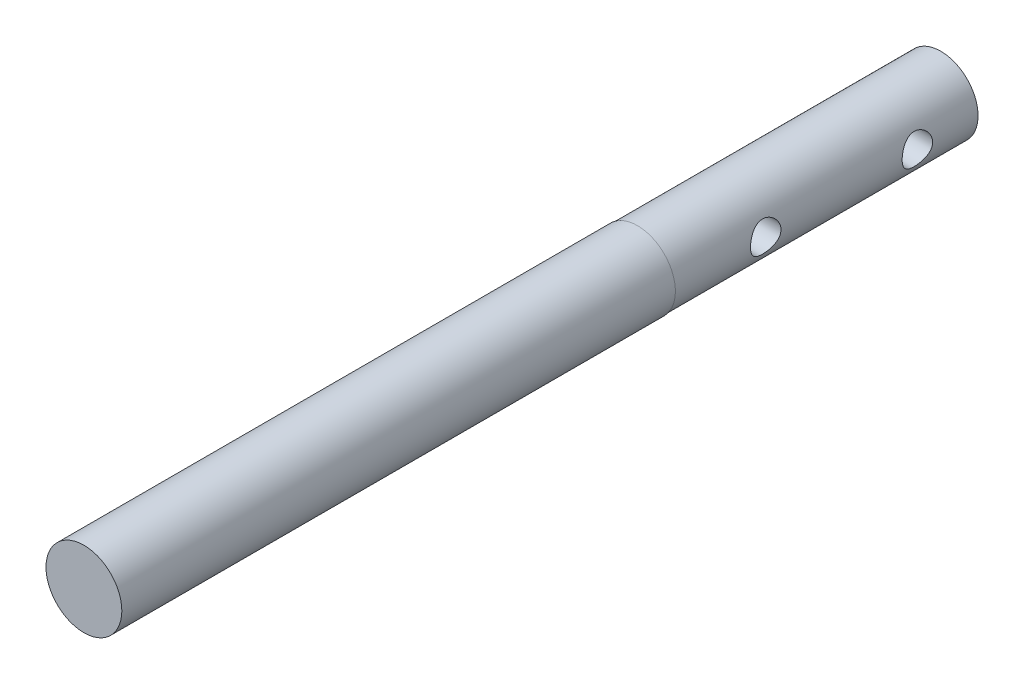
from build123d import *

# Parameters (mm, degrees)
SKETCH1_R               = 25
BOSS_EXTRUDE1_DEPTH     = 282.5
CUT_EXTRUDE1_DEPTH      = 285.703793442
CUT_EXTRUDE1_DEPTH_BACK = 285.703793442
SKETCH2_R               = 10.05
CUT_EXTRUDE2_DEPTH      = 10
SKETCH4_OUTSIDE_W       = 165.882
SKETCH4_OUTSIDE_H       = 165.882
SKETCH4_OUTSIDE_R       = 24.61
CUT_EXTRUDE3_DEPTH      = 200


with BuildPart() as part:
    # Sketch1 → Boss-Extrude1 (new, symmetric)
    with BuildSketch(Plane.XY):
        Circle(SKETCH1_R)
    extrude(amount=BOSS_EXTRUDE1_DEPTH, both=True)

    # Sketch2 → Cut-Extrude1 (cut, two sides: drawn at the far end of the back side and taken through both)
    with BuildSketch(Plane(origin=(0, 0, 0), x_dir=(0, 0, -1), z_dir=(1, 0, 0)).offset(-CUT_EXTRUDE1_DEPTH_BACK)):
        with Locations(Location((142.5, 0, 0), (0, 0, 180))):
            Circle(SKETCH2_R)
        with Locations(Location((242.5, 0, 0), (0, 0, 180))):
            Circle(SKETCH2_R)
    extrude(amount=CUT_EXTRUDE1_DEPTH + CUT_EXTRUDE1_DEPTH_BACK, mode=Mode.SUBTRACT)

    # Sketch3 → Cut-Extrude2 (cut)
    with BuildSketch(Plane(origin=(-18.5, 0, 0), x_dir=(0, 0, -1), z_dir=(1, 0, 0))):
        with BuildLine():
            Line((-262.5, -7), (-220.5, -7))
            ThreePointArc((-220.5, -7), (-213.5, 0), (-220.5, 7))
            Line((-220.5, 7), (-262.5, 7))
            ThreePointArc((-262.5, 7), (-269.5, 0), (-262.5, -7))
        make_face()
    extrude(amount=-CUT_EXTRUDE2_DEPTH, mode=Mode.SUBTRACT)

    # Sketch4 outside → Cut-Extrude3 (cut)
    with BuildSketch(Plane(origin=(0, 0, -282.5), x_dir=(-1, 0, 0), z_dir=(0, 0, -1))):
        Rectangle(SKETCH4_OUTSIDE_W, SKETCH4_OUTSIDE_H)
        Circle(SKETCH4_OUTSIDE_R, mode=Mode.SUBTRACT)
    extrude(amount=-CUT_EXTRUDE3_DEPTH, mode=Mode.SUBTRACT)


solid = part.part
